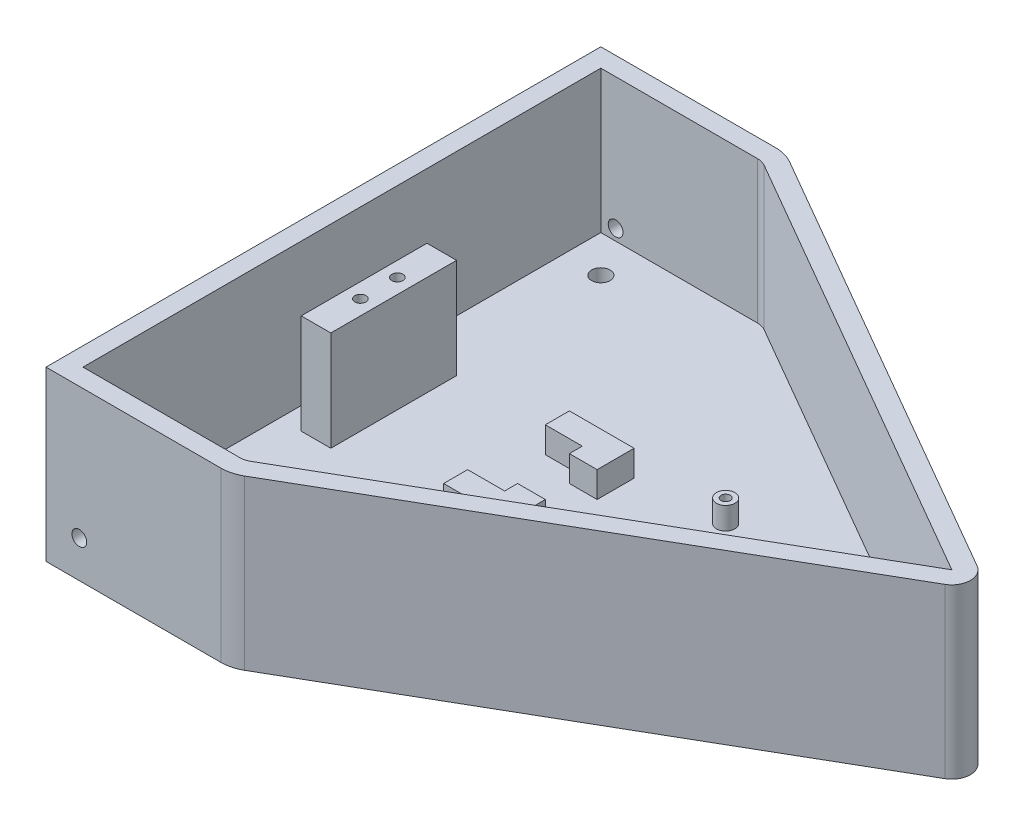
from build123d import *

# Parameters (mm, degrees)
BOSS_EXTRUDE1_DEPTH = 7
FILLET1_R           = 5
FILLET2_R           = 10
CUT_EXTRUDE1_REACH  = 131.101
SKETCH3_R           = 2.5
BOSS_EXTRUDE2_DEPTH = 6
SKETCH7_W           = 4
SKETCH7_H           = 10
BOSS_EXTRUDE3_DEPTH = 27
SKETCH8_R           = 1.5
CUT_EXTRUDE2_DEPTH  = 10
BOSS_EXTRUDE4_DEPTH = 7
BOSS_EXTRUDE5_DEPTH = 7
BOSS_EXTRUDE6_DEPTH = 38.5
SKETCH14_R          = 2
CUT_EXTRUDE3_DEPTH  = 10
CUT_EXTRUDE4_START  = -10
SKETCH15_R          = 2
CUT_EXTRUDE4_DEPTH  = 10


with BuildPart() as part:
    # Sketch1 → Boss-Extrude1 (new body)
    with BuildSketch(Plane(origin=(0, 0, 0), x_dir=(1, 0, 0), z_dir=(0, 1, 0))):
        Polygon((75.055534995, 0), (-54.848275573, 75), (-104.848275573, 75), (-104.848275573, -75), (-54.848275573, -75), align=None)
    extrude(amount=BOSS_EXTRUDE1_DEPTH)

    # Fillet1
    fillet1_edges = [part.edges().sort_by_distance(p)[0] for p in [
        (75.055534995, 3.5, 0),
    ]]
    fillet(fillet1_edges, radius=FILLET1_R)

    # Fillet2
    fillet2_edges = [part.edges().sort_by_distance(p)[0] for p in [
        (-54.848275573, 3.5, 75),
        (-54.848275573, 3.5, -75),
    ]]
    fillet(fillet2_edges, radius=FILLET2_R)

    # Sketch3 → Cut-Extrude1 (cut, up to next)
    with BuildSketch(Plane(origin=(0, 7, 0), x_dir=(1, 0, 0), z_dir=(0, 1, 0)), mode=Mode.PRIVATE) as cut_extrude1_sk1:
        with Locations(Location((-89.848275573, 60, 0), (0, 0, 270))):
            Circle(SKETCH3_R)
    cut_extrude1_tool1 = extrude(cut_extrude1_sk1.sketch, amount=-CUT_EXTRUDE1_REACH, mode=Mode.PRIVATE) & part.part
    # Sketch3 → Cut-Extrude1 (cut, up to next)
    with BuildSketch(Plane(origin=(0, 7, 0), x_dir=(1, 0, 0), z_dir=(0, 1, 0)), mode=Mode.PRIVATE) as cut_extrude1_sk2:
        with Locations(Location((-89.848275573, -60, 0), (0, 0, 270))):
            Circle(SKETCH3_R)
    cut_extrude1_tool2 = extrude(cut_extrude1_sk2.sketch, amount=-CUT_EXTRUDE1_REACH, mode=Mode.PRIVATE) & part.part
    add(cut_extrude1_tool1.solids().sort_by_distance((-89.848276, 7, -60))[0], mode=Mode.SUBTRACT)
    add(cut_extrude1_tool2.solids().sort_by_distance((-89.848276, 7, 60))[0], mode=Mode.SUBTRACT)

    # Sketch6 → Boss-Extrude2 (add)
    with BuildSketch(Plane(origin=(0, 7, 0), x_dir=(1, 0, 0), z_dir=(0, 1, 0))):
        with BuildLine():
            ThreePointArc((-14.848275573, 17.5), (-15.732159049, 19.633883476), (-13.598275573, 18.75))
            Line((-13.598275573, 18.75), (-12.348275573, 18.75))
            ThreePointArc((-12.348275573, 18.75), (-16.616042526, 20.517766953), (-14.848275573, 16.25))
            Line((-14.848275573, 16.25), (-14.848275573, 17.5))
        make_face()
        with BuildLine():
            Line((-12.348275573, 18.75), (-13.598275573, 18.75))
            ThreePointArc((-13.598275573, 18.75), (-13.964392097, 17.866116524), (-14.848275573, 17.5))
            Line((-14.848275573, 17.5), (-14.848275573, 16.25))
            ThreePointArc((-14.848275573, 16.25), (-13.08050862, 16.982233047), (-12.348275573, 18.75))
        make_face()
        with BuildLine():
            ThreePointArc((23.901724427, 18.75), (23.535607903, 17.866116524), (22.651724427, 17.5))
            Line((22.651724427, 17.5), (22.651724427, 16.25))
            ThreePointArc((22.651724427, 16.25), (24.41949138, 16.982233047), (25.151724427, 18.75))
            ThreePointArc((25.151724427, 18.75), (22.651724427, 21.25), (20.151724427, 18.75))
            Line((20.151724427, 18.75), (21.401724427, 18.75))
            ThreePointArc((21.401724427, 18.75), (22.651724427, 20), (23.901724427, 18.75))
        make_face()
        with BuildLine():
            Line((22.651724427, 16.25), (22.651724427, 17.5))
            ThreePointArc((22.651724427, 17.5), (21.767840951, 17.866116524), (21.401724427, 18.75))
            Line((21.401724427, 18.75), (20.151724427, 18.75))
            ThreePointArc((20.151724427, 18.75), (20.883957474, 16.982233047), (22.651724427, 16.25))
        make_face()
        with BuildLine():
            ThreePointArc((22.651724427, -16.25), (20.883957474, -16.982233047), (20.151724427, -18.75))
            Line((20.151724427, -18.75), (21.401724427, -18.75))
            ThreePointArc((21.401724427, -18.75), (21.767840951, -17.866116524), (22.651724427, -17.5))
            Line((22.651724427, -17.5), (22.651724427, -16.25))
        make_face()
        with BuildLine():
            Line((21.401724427, -18.75), (20.151724427, -18.75))
            ThreePointArc((20.151724427, -18.75), (22.651724427, -21.25), (25.151724427, -18.75))
            ThreePointArc((25.151724427, -18.75), (24.41949138, -16.982233047), (22.651724427, -16.25))
            Line((22.651724427, -16.25), (22.651724427, -17.5))
            ThreePointArc((22.651724427, -17.5), (23.535607903, -17.866116524), (23.901724427, -18.75))
            ThreePointArc((23.901724427, -18.75), (22.651724427, -20), (21.401724427, -18.75))
        make_face()
        with BuildLine():
            ThreePointArc((-14.848275573, -17.5), (-13.964392097, -17.866116524), (-13.598275573, -18.75))
            Line((-13.598275573, -18.75), (-12.348275573, -18.75))
            ThreePointArc((-12.348275573, -18.75), (-13.08050862, -16.982233047), (-14.848275573, -16.25))
            Line((-14.848275573, -16.25), (-14.848275573, -17.5))
        make_face()
        with BuildLine():
            Line((-12.348275573, -18.75), (-13.598275573, -18.75))
            ThreePointArc((-13.598275573, -18.75), (-15.732159049, -19.633883476), (-14.848275573, -17.5))
            Line((-14.848275573, -17.5), (-14.848275573, -16.25))
            ThreePointArc((-14.848275573, -16.25), (-16.616042526, -20.517766953), (-12.348275573, -18.75))
        make_face()
    extrude(amount=BOSS_EXTRUDE2_DEPTH)

    # Sketch7 → Boss-Extrude3 (add)
    with BuildSketch(Plane(origin=(0, 7, 0), x_dir=(1, 0, 0), z_dir=(0, 1, 0))):
        Polygon((-89.848275573, 5), (-85.848275573, 5), (-85.848275573, 17), (-93.848275573, 17), (-93.848275573, -17), (-85.848275573, -17), (-85.848275573, -5), (-89.848275573, -5), align=None)
        with Locations((-87.848275573, 0)):
            Rectangle(SKETCH7_W, SKETCH7_H)
    extrude(amount=BOSS_EXTRUDE3_DEPTH)

    # Sketch8 → Cut-Extrude2 (cut)
    with BuildSketch(Plane(origin=(0, 34, 0), x_dir=(1, 0, 0), z_dir=(0, 1, 0))):
        with Locations(Location((-89.848275573, -5, 0), (0, 0, 270))):
            Circle(SKETCH8_R)
        with Locations(Location((-89.848275573, 5, 0), (0, 0, 270))):
            Circle(SKETCH8_R)
    extrude(amount=-CUT_EXTRUDE2_DEPTH, mode=Mode.SUBTRACT)

    # Sketch7<4> → Boss-Extrude4 (add)
    with BuildSketch(Plane(origin=(0, 7, 0), x_dir=(1, 0, 0), z_dir=(0, 1, 0))):
        Polygon((-45.848275573, -17), (-37.848275573, -17), (-37.848275573, -7), (-45.348275573, -7), (-45.348275573, -10.506475343), (-55.348275573, -10.506475343), (-55.348275573, -17), align=None)
    extrude(amount=BOSS_EXTRUDE4_DEPTH)

    # Sketch7<5> → Boss-Extrude5 (add)
    with BuildSketch(Plane(origin=(0, 7, 0), x_dir=(1, 0, 0), z_dir=(0, 1, 0))):
        Polygon((-45.848275573, 17), (-37.848275573, 17), (-37.848275573, 7), (-45.348275573, 7), (-45.348275573, 10.493524657), (-55.348275573, 10.493524657), (-55.348275573, 17), align=None)
    extrude(amount=BOSS_EXTRUDE5_DEPTH)

    # Sketch11 → Boss-Extrude6 (add)
    with BuildSketch(Plane(origin=(0, 7, 0), x_dir=(1, 0, 0), z_dir=(0, 1, 0))):
        with BuildLine():
            Line((-104.848275573, 75), (-104.848275573, -75))
            Line((-104.848275573, -75), (-57.527767497, -75))
            ThreePointArc((-57.527767497, -75), (-54.939577046, -74.659258263), (-52.527767497, -73.660254038))
            Line((-52.527767497, -73.660254038), (67.555534995, -4.330127019))
            ThreePointArc((67.555534995, -4.330127019), (70.055534995, 0), (67.555534995, 4.330127019))
            Line((67.555534995, 4.330127019), (-52.527767497, 73.660254038))
            ThreePointArc((-52.527767497, 73.660254038), (-54.939577046, 74.659258263), (-57.527767497, 75))
            Line((-57.527767497, 75), (-104.848275573, 75))
        make_face()
        with BuildLine():
            ThreePointArc((-55.027767497, 69.330127019), (-56.233672272, 69.829629131), (-57.527767497, 70))
            Line((-57.527767497, 70), (-99.848275573, 70))
            Line((-99.848275573, 70), (-99.848275573, -70))
            Line((-99.848275573, -70), (-57.527767497, -70))
            ThreePointArc((-57.527767497, -70), (-56.233672272, -69.829629131), (-55.027767497, -69.330127019))
            Line((-55.027767497, -69.330127019), (65.055534995, 0))
            Line((65.055534995, 0), (-55.027767497, 69.330127019))
        make_face(mode=Mode.SUBTRACT)
    extrude(amount=BOSS_EXTRUDE6_DEPTH)

    # Sketch14 → Cut-Extrude3 (cut)
    with BuildSketch(Plane.XY.offset(75)):
        with Locations((-95.848275573, 10)):
            Circle(SKETCH14_R)
    extrude(amount=-CUT_EXTRUDE3_DEPTH, mode=Mode.SUBTRACT)

    # Sketch15 → Cut-Extrude4 (cut)
    with BuildSketch(Plane(origin=(0, 0, -75), x_dir=(-1, 0, 0), z_dir=(0, 0, -1)).offset(CUT_EXTRUDE4_START)):
        with Locations(Location((95.848275573, 10, 0), (0, 0, 180))):
            Circle(SKETCH15_R)
    extrude(amount=CUT_EXTRUDE4_DEPTH, mode=Mode.SUBTRACT)


solid = part.part
